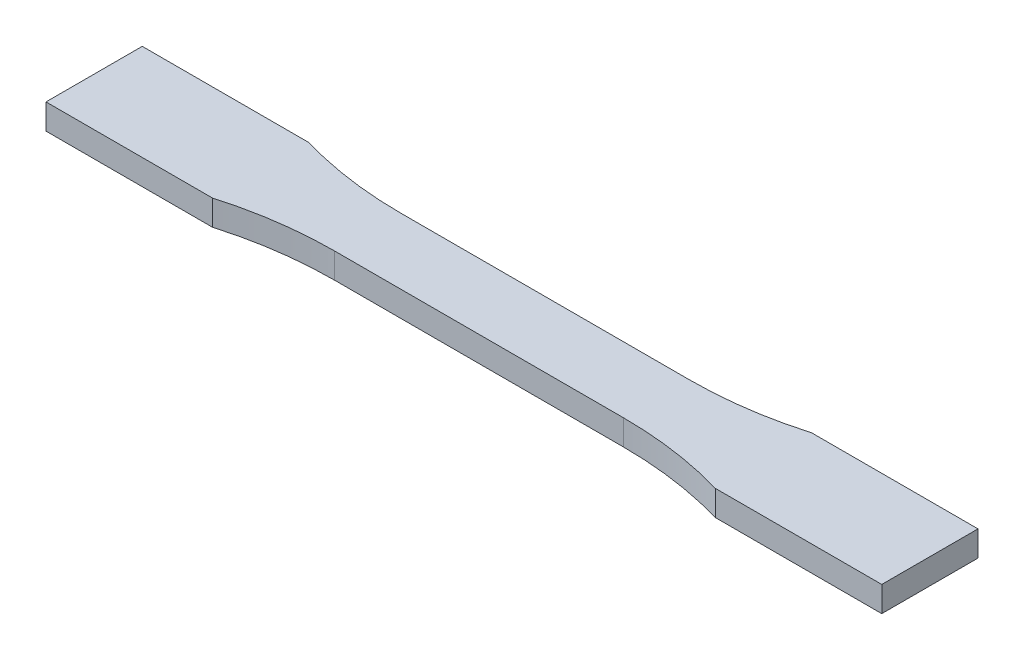
from build123d import *

# Parameters (mm, degrees)
EXTRUDE_1_DEPTH = 2.5


with BuildPart() as part:
    # 스케치1 → 보스-돌출1 (new, symmetric)
    with BuildSketch(Plane(origin=(0, 0, 0), x_dir=(1, 0, 0), z_dir=(0, 1, 0))):
        with BuildLine():
            Line((-49.642374512, -9.5), (-82.5, -9.5))
            Line((-82.5, -9.5), (-82.5, 9.5))
            Line((-82.5, 9.5), (-49.642374512, 9.5))
            ThreePointArc((-49.642374512, 9.5), (-39.177078252, 7.253737634), (-28.5, 6.5))
            Line((-28.5, 6.5), (28.5, 6.5))
            ThreePointArc((28.5, 6.5), (39.177078252, 7.253737634), (49.642374512, 9.5))
            Line((49.642374512, 9.5), (82.5, 9.5))
            Line((82.5, 9.5), (82.5, -9.5))
            Line((82.5, -9.5), (49.642374512, -9.5))
            ThreePointArc((49.642374512, -9.5), (39.177078252, -7.253737634), (28.5, -6.5))
            Line((28.5, -6.5), (-28.5, -6.5))
            ThreePointArc((-28.5, -6.5), (-39.177078252, -7.253737634), (-49.642374512, -9.5))
        make_face()
    extrude(amount=EXTRUDE_1_DEPTH, both=True)


solid = part.part
